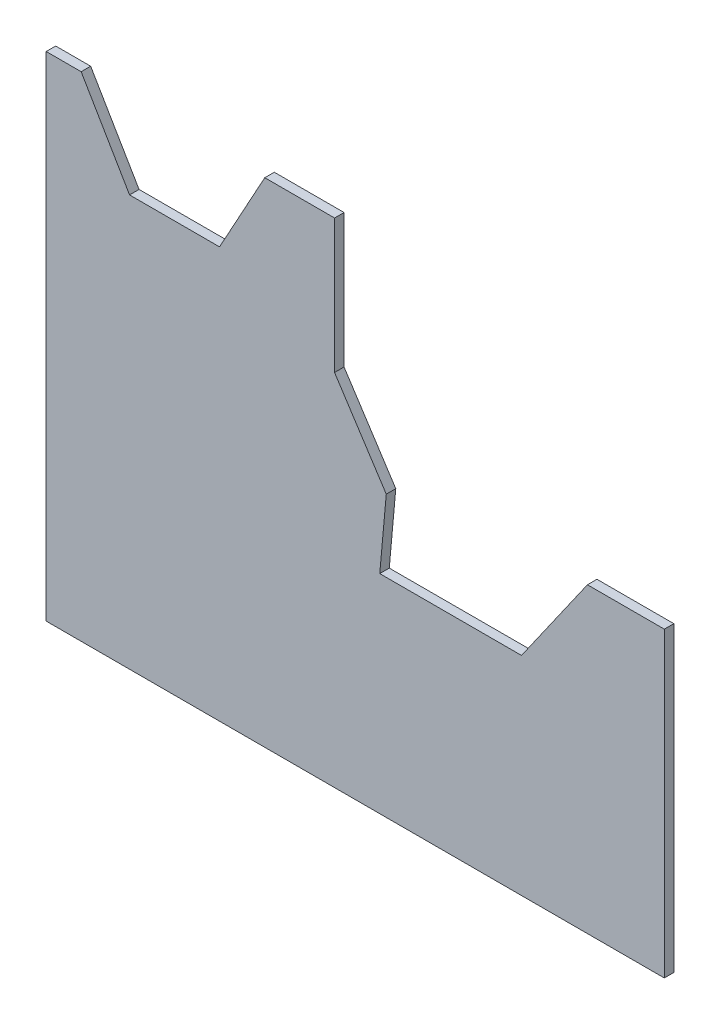
from build123d import *

# Parameters (mm, degrees)
BOSS_EXTRUDE1_DEPTH = 0.8


with BuildPart() as part:
    # Sketch1 → Boss-Extrude1 (new body)
    with BuildSketch(Plane.XY):
        Polygon((11.279813794, -8.082980903), (4.81300376, -8.082980903), (-0.734771552, -16.006025157), (-12.657667734, -16.006025157), (-12.110728396, -9.944812956), (-16.460344929, -3.254364839), (-16.460344929, 8.000755607), (-22.330523841, 8.000755607), (-26.136647301, 1.058600844), (-33.707027573, 1.058600844), (-37.778839094, 8.000755607), (-40.720186206, 8.000755607), (-40.720186206, -33.5), (11.279813794, -33.5), align=None)
    extrude(amount=BOSS_EXTRUDE1_DEPTH)


solid = part.part
